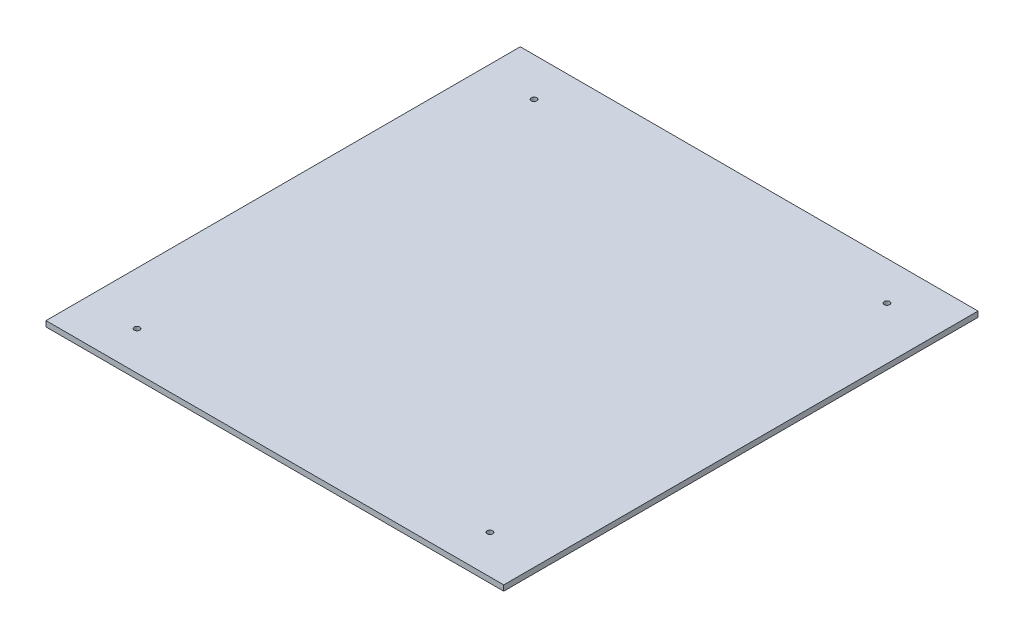
from build123d import *

# Parameters (mm, degrees)
CROQUIS1_W              = 415
CROQUIS1_H              = 430
SALIENTE_EXTRUIR1_DEPTH = 5
CROQUIS2_R              = 2.5
CORTAR_EXTRUIR1_DEPTH   = 299.84151318


with BuildPart() as part:
    # Croquis1 → Saliente-Extruir1 (new body)
    with BuildSketch(Plane(origin=(0, 0, 0), x_dir=(1, 0, 0), z_dir=(0, 1, 0))):
        Rectangle(CROQUIS1_W, CROQUIS1_H)
    extrude(amount=SALIENTE_EXTRUIR1_DEPTH)

    # Croquis2 → Cortar-Extruir1 (cut, through all)
    with BuildSketch(Plane(origin=(0, 5, 0), x_dir=(1, 0, 0), z_dir=(0, 1, 0))):
        with Locations(Location((-160, 180, 0), (0, 0, 270))):
            Circle(CROQUIS2_R)
        with Locations(Location((160, 180, 0), (0, 0, 90))):
            Circle(CROQUIS2_R)
        with Locations(Location((160, -180, 0), (0, 0, 270))):
            Circle(CROQUIS2_R)
        with Locations(Location((-160, -180, 0), (0, 0, 90))):
            Circle(CROQUIS2_R)
    extrude(amount=-CORTAR_EXTRUIR1_DEPTH, mode=Mode.SUBTRACT)


solid = part.part
